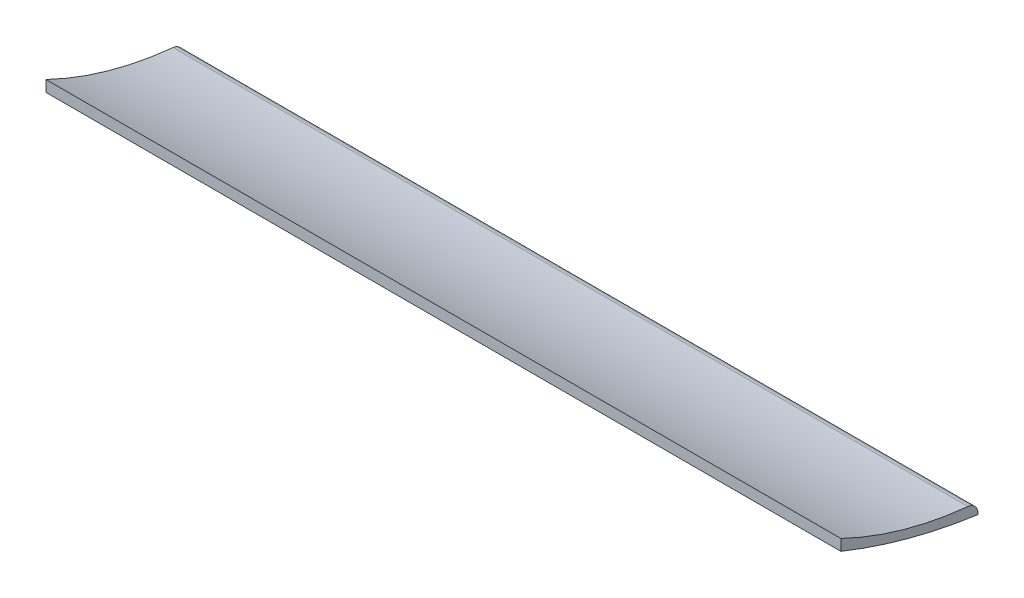
from build123d import *

# Parameters (mm, degrees)
BOSS_EXTRUDE1_DEPTH = 711.2
FILLET1_R           = 10


with BuildPart() as part:
    # Sketch1 → Boss-Extrude1 (new body)
    with BuildSketch(Plane(origin=(0, 0, 0), x_dir=(0, 0, -1), z_dir=(1, 0, 0))):
        with BuildLine():
            Line((122.672579939, -32.870018728), (122.672579939, -22.870018728))
            ThreePointArc((122.672579939, -22.870018728), (59.787928159, -12.213574307), (0, 10))
            Line((0, 10), (0, 0))
            ThreePointArc((0, 0), (60.329037039, -20.194128476), (122.672579939, -32.870018728))
        make_face()
    extrude(amount=BOSS_EXTRUDE1_DEPTH)

    # Fillet1
    fillet1_edges = [part.edges().sort_by_distance(p)[0] for p in [
        (355.6, -22.870018728, -122.672579939),
    ]]
    fillet(fillet1_edges, radius=FILLET1_R)


solid = part.part
